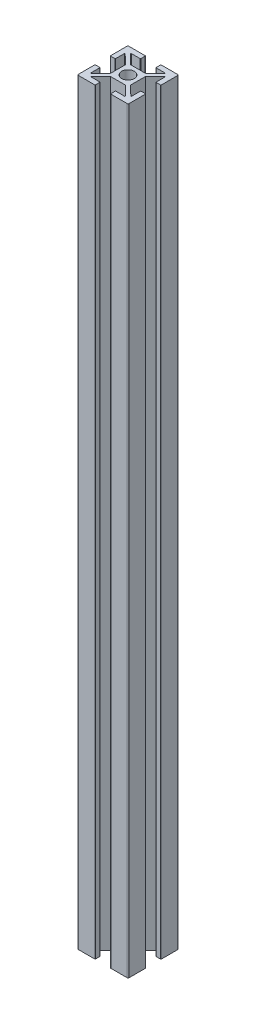
from build123d import *

# Parameters (mm, degrees)
SKETCH1_R           = 2.5
BOSS_EXTRUDE2_DEPTH = 300


with BuildPart() as part:
    # Sketch1 → Boss-Extrude2 (new body)
    with BuildSketch(Plane(origin=(0, 0, 0), x_dir=(1, 0, 0), z_dir=(0, 1, 0))):
        with BuildLine():
            Line((-9.896296296, 3), (-8.196296296, 3))
            ThreePointArc((-8.196296296, 3), (-8.090230279, 3.043933983), (-8.046296296, 3.15))
            Line((-8.046296296, 3.15), (-8.046296296, 6.586184513))
            ThreePointArc((-8.046296296, 6.586184513), (-7.954097251, 6.724600732), (-7.790842301, 6.692859041))
            Line((-7.790842301, 6.692859041), (-4, 2.945390222))
            Line((-4, 2.945390222), (-4, -2.945390222))
            Line((-4, -2.945390222), (-7.790842301, -6.692859041))
            ThreePointArc((-7.790842301, -6.692859041), (-7.954097251, -6.724600732), (-8.046296296, -6.586184513))
            Line((-8.046296296, -6.586184513), (-8.046296296, -3.15))
            ThreePointArc((-8.046296296, -3.15), (-8.090230279, -3.043933983), (-8.196296296, -3))
            Line((-8.196296296, -3), (-9.896296296, -3))
            ThreePointArc((-9.896296296, -3), (-10.002362313, -3.043933983), (-10.046296296, -3.15))
            Line((-10.046296296, -3.15), (-10.046296296, -9.65))
            ThreePointArc((-10.046296296, -9.65), (-9.94378367, -9.897487373), (-9.696296296, -10))
            Line((-9.696296296, -10), (-3.196296296, -10))
            ThreePointArc((-3.196296296, -10), (-3.090230279, -9.956066017), (-3.046296296, -9.85))
            Line((-3.046296296, -9.85), (-3.046296296, -8.15))
            ThreePointArc((-3.046296296, -8.15), (-3.090230279, -8.043933983), (-3.196296296, -8))
            Line((-3.196296296, -8), (-6.614381093, -8))
            ThreePointArc((-6.614381093, -8), (-6.753127587, -7.9070036), (-6.719835089, -7.743325472))
            Line((-6.719835089, -7.743325472), (-2.93318409, -4))
            Line((-2.93318409, -4), (2.93318409, -4))
            Line((2.93318409, -4), (6.719835089, -7.743325472))
            ThreePointArc((6.719835089, -7.743325472), (6.753127587, -7.9070036), (6.614381093, -8))
            Line((6.614381093, -8), (3.196296296, -8))
            ThreePointArc((3.196296296, -8), (3.090230279, -8.043933983), (3.046296296, -8.15))
            Line((3.046296296, -8.15), (3.046296296, -9.85))
            ThreePointArc((3.046296296, -9.85), (3.090230279, -9.956066017), (3.196296296, -10))
            Line((3.196296296, -10), (9.696296296, -10))
            ThreePointArc((9.696296296, -10), (9.94378367, -9.897487373), (10.046296296, -9.65))
            Line((10.046296296, -9.65), (10.046296296, -3.15))
            ThreePointArc((10.046296296, -3.15), (10.002362313, -3.043933983), (9.896296296, -3))
            Line((9.896296296, -3), (8.196296296, -3))
            ThreePointArc((8.196296296, -3), (8.090230279, -3.043933983), (8.046296296, -3.15))
            Line((8.046296296, -3.15), (8.046296296, -6.586184513))
            ThreePointArc((8.046296296, -6.586184513), (7.954097251, -6.724600732), (7.790842301, -6.692859041))
            Line((7.790842301, -6.692859041), (4, -2.945390222))
            Line((4, -2.945390222), (4, 2.945390222))
            Line((4, 2.945390222), (7.790842301, 6.692859041))
            ThreePointArc((7.790842301, 6.692859041), (7.954097251, 6.724600732), (8.046296296, 6.586184513))
            Line((8.046296296, 6.586184513), (8.046296296, 3.15))
            ThreePointArc((8.046296296, 3.15), (8.090230279, 3.043933983), (8.196296296, 3))
            Line((8.196296296, 3), (9.896296296, 3))
            ThreePointArc((9.896296296, 3), (10.002362313, 3.043933983), (10.046296296, 3.15))
            Line((10.046296296, 3.15), (10.046296296, 9.65))
            ThreePointArc((10.046296296, 9.65), (9.94378367, 9.897487373), (9.696296296, 10))
            Line((9.696296296, 10), (3.196296296, 10))
            ThreePointArc((3.196296296, 10), (3.090230279, 9.956066017), (3.046296296, 9.85))
            Line((3.046296296, 9.85), (3.046296296, 8.15))
            ThreePointArc((3.046296296, 8.15), (3.090230279, 8.043933983), (3.196296296, 8))
            Line((3.196296296, 8), (6.614381093, 8))
            ThreePointArc((6.614381093, 8), (6.753127587, 7.9070036), (6.719835089, 7.743325472))
            Line((6.719835089, 7.743325472), (2.93318409, 4))
            Line((2.93318409, 4), (-2.93318409, 4))
            Line((-2.93318409, 4), (-6.719835089, 7.743325472))
            ThreePointArc((-6.719835089, 7.743325472), (-6.753127587, 7.9070036), (-6.614381093, 8))
            Line((-6.614381093, 8), (-3.196296296, 8))
            ThreePointArc((-3.196296296, 8), (-3.090230279, 8.043933983), (-3.046296296, 8.15))
            Line((-3.046296296, 8.15), (-3.046296296, 9.85))
            ThreePointArc((-3.046296296, 9.85), (-3.090230279, 9.956066017), (-3.196296296, 10))
            Line((-3.196296296, 10), (-9.696296296, 10))
            ThreePointArc((-9.696296296, 10), (-9.94378367, 9.897487373), (-10.046296296, 9.65))
            Line((-10.046296296, 9.65), (-10.046296296, 3.15))
            ThreePointArc((-10.046296296, 3.15), (-10.002362313, 3.043933983), (-9.896296296, 3))
        make_face()
        with Locations(Location((0, 0, 0), (0, 0, 270))):
            Circle(SKETCH1_R, mode=Mode.SUBTRACT)
    extrude(amount=BOSS_EXTRUDE2_DEPTH)


solid = part.part
